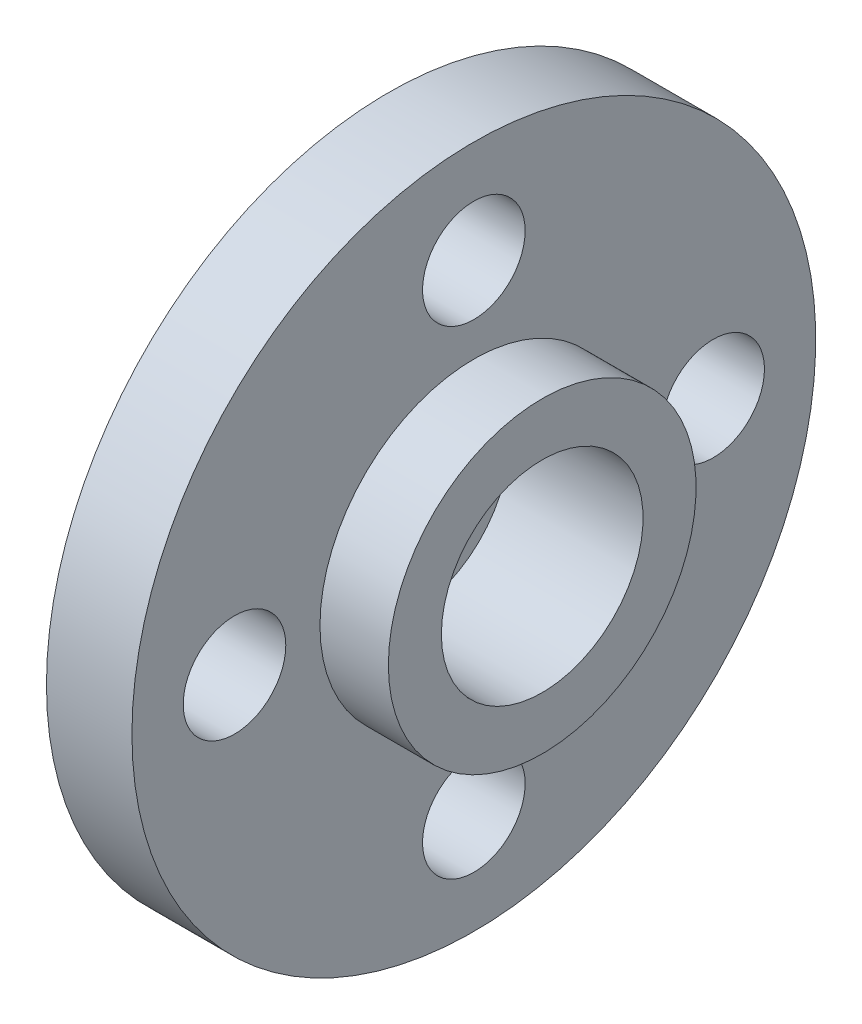
from build123d import *

# Parameters (mm, degrees)
SKETCH_2_R          = 1.5
CUT_EXTRUDE_1_DEPTH = 10


with BuildPart() as part:
    # 草图1 → 旋转1 (revolve)
    with BuildSketch(Plane.XY, mode=Mode.PRIVATE) as revolve_1_sk:
        Polygon((-2.579365079, 1.5), (-2.579365079, 10), (-0.079365079, 10), (-0.079365079, 4.5), (1.920634921, 4.5), (1.920634921, 2.95), (-1.989795918, 2.95), (-1.989795918, 1.5), align=None)
    revolve(revolve_1_sk.sketch.rotate(Axis((-8.588435374, 0, 0), (1, 0, 0)), 90), axis=Axis((-8.588435374, 0, 0), (1, 0, 0)))

    # 草图2 → 切除-拉伸1 (cut)
    with BuildSketch(Plane(origin=(-0.079365079, 0, 0), x_dir=(0, 0, -1), z_dir=(1, 0, 0))):
        with Locations((0, 7)):
            Circle(SKETCH_2_R)
        with Locations((7, 0)):
            Circle(SKETCH_2_R)
        with Locations((0, -7)):
            Circle(SKETCH_2_R)
        with Locations((-7, 0)):
            Circle(SKETCH_2_R)
    extrude(amount=-CUT_EXTRUDE_1_DEPTH, mode=Mode.SUBTRACT)


solid = part.part
